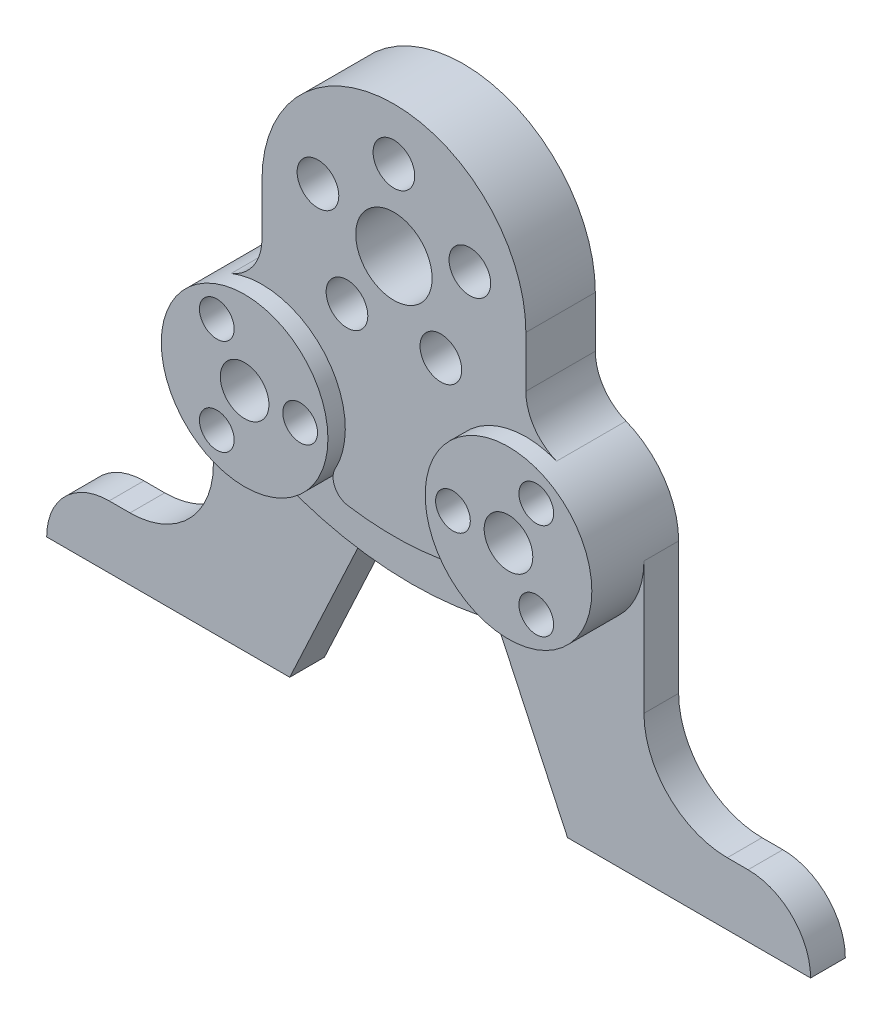
from build123d import *

# Parameters (mm, degrees)
EXTRUDE_1_DEPTH   = 10
EXTRUDE_1_2_DEPTH = 10
SKETCH_1_3_R      = 6
SKETCH_1_3_R_2    = 11
EXTRUDE_2_DEPTH   = 20
EXTRUDE_3_DEPTH   = 15
SKETCH_1_5_R      = 24
SKETCH_1_5_R_2    = 5
SKETCH_1_5_R_3    = 7
EXTRUDE_4_DEPTH   = 25


with BuildPart() as part:
    # Эскиз1 → Бобышка-Вытянуть1 (new body)
    with BuildSketch(Plane.XY):
        with BuildLine():
            ThreePointArc((-50, -70.784609691), (-58.784609691, -62), (-62, -50))
            Line((-62, -50), (-62, -88))
            ThreePointArc((-62, -88), (-69.029437252, -104.970562748), (-86, -112))
            Line((-86, -112), (-92, -112))
            ThreePointArc((-92, -112), (-104.727922061, -117.272077939), (-110, -130))
            Line((-110, -130), (-40, -130))
            Line((-40, -130), (-20.413213913, -87.996001687))
            ThreePointArc((-20.413213913, -87.996001687), (-17.041200429, -84.37997452), (-12.187732979, -83.436586413))
            ThreePointArc((-12.187732979, -83.436586413), (-31.730847168, -79.014307175), (-50, -70.784609691))
        make_face()
    extrude(amount=EXTRUDE_1_DEPTH)



with BuildPart() as body_2:
    # Эскиз1 → Extrude 1 2 (new body)
    with BuildSketch(Plane.XY):
        with BuildLine():
            Line((62, -88), (62, -50))
            ThreePointArc((62, -50), (58.784609691, -62), (50, -70.784609691))
            ThreePointArc((50, -70.784609691), (31.730847168, -79.014307175), (12.187732979, -83.436586413))
            ThreePointArc((12.187732979, -83.436586413), (17.041200429, -84.37997452), (20.413213913, -87.996001687))
            Line((20.413213913, -87.996001687), (40, -130))
            Line((40, -130), (110, -130))
            ThreePointArc((110, -130), (104.727922061, -117.272077939), (92, -112))
            Line((92, -112), (86, -112))
            ThreePointArc((86, -112), (69.029437252, -104.970562748), (62, -88))
        make_face()
    extrude(amount=EXTRUDE_1_2_DEPTH)


with BuildPart() as body_3:
    # Эскиз1<3> → Бобышка-Вытянуть2 (new body)
    with BuildSketch(Plane.XY):
        with BuildLine():
            ThreePointArc((38, 0), (0, 38), (-38, 0))
            Line((-38, 0), (-38, -14.672956535))
            ThreePointArc((-38, -14.672956535), (-40.419617314, -22.540277352), (-46.842105263, -27.688183075))
            ThreePointArc((-46.842105263, -27.688183075), (-42.500910674, -26.425823384), (-38, -26))
            ThreePointArc((-38, -26), (-21.029437252, -33.029437252), (-14, -50))
            ThreePointArc((-14, -50), (-14.740639422, -55.916261107), (-16.916845457, -61.467370864))
            ThreePointArc((-16.916845457, -61.467370864), (-17.009837453, -66.065918092), (-13.307304194, -68.794751467))
            ThreePointArc((-13.307304194, -68.794751467), (0, -69.842886359), (13.307304194, -68.794751467))
            ThreePointArc((13.307304194, -68.794751467), (17.009837453, -66.065918092), (16.916845457, -61.467370864))
            ThreePointArc((16.916845457, -61.467370864), (20.035612902, -34.085201974), (46.842105263, -27.688183075))
            ThreePointArc((46.842105263, -27.688183075), (40.419617314, -22.540277352), (38, -14.672956535))
            Line((38, -14.672956535), (38, 0))
        make_face()
        with Locations((-13.519060803, -18.607390871)):
            Circle(SKETCH_1_3_R, mode=Mode.SUBTRACT)
        Circle(SKETCH_1_3_R_2, mode=Mode.SUBTRACT)
        with Locations((-21.874299875, 7.107390871)):
            Circle(SKETCH_1_3_R, mode=Mode.SUBTRACT)
        with Locations((0, 23)):
            Circle(SKETCH_1_3_R, mode=Mode.SUBTRACT)
        with Locations((13.519060803, -18.607390871)):
            Circle(SKETCH_1_3_R, mode=Mode.SUBTRACT)
        with Locations((21.874299875, 7.107390871)):
            Circle(SKETCH_1_3_R, mode=Mode.SUBTRACT)
    extrude(amount=EXTRUDE_2_DEPTH)


with BuildPart() as part_1:
    add(part.part)

    add(body_2.part)  # Бобышка-Вытянуть3 merges body 2

    add(body_3.part)  # Бобышка-Вытянуть3 merges body 3
    # Эскиз1<4> → Бобышка-Вытянуть3 (add)
    with BuildSketch(Plane.XY):
        with BuildLine():
            ThreePointArc((-16.916845457, -61.467370864), (-31.493952125, -73.10132769), (-50, -70.784609691))
            ThreePointArc((-50, -70.784609691), (-31.730847168, -79.014307175), (-12.187732979, -83.436586413))
            ThreePointArc((-12.187732979, -83.436586413), (0, -84.182069312), (12.187732979, -83.436586413))
            ThreePointArc((12.187732979, -83.436586413), (31.730847168, -79.014307175), (50, -70.784609691))
            ThreePointArc((50, -70.784609691), (31.493952125, -73.10132769), (16.916845457, -61.467370864))
            ThreePointArc((16.916845457, -61.467370864), (17.009837453, -66.065918092), (13.307304194, -68.794751467))
            ThreePointArc((13.307304194, -68.794751467), (0, -69.842886359), (-13.307304194, -68.794751467))
            ThreePointArc((-13.307304194, -68.794751467), (-17.009837453, -66.065918092), (-16.916845457, -61.467370864))
        make_face()
    extrude(amount=EXTRUDE_3_DEPTH)

    # Эскиз1<5> → Бобышка-Вытянуть4 (add)
    # profile 1 of 2: a face of its own
    with BuildSketch(Plane.XY):
        with Locations((-38, -50)):
            Circle(SKETCH_1_5_R)
        with Locations((-46, -63.856406461)):
            Circle(SKETCH_1_5_R_2, mode=Mode.SUBTRACT)
        with Locations((-38, -50)):
            Circle(SKETCH_1_5_R_3, mode=Mode.SUBTRACT)
        with Locations((-22, -50)):
            Circle(SKETCH_1_5_R_2, mode=Mode.SUBTRACT)
        with Locations((-46, -36.143593539)):
            Circle(SKETCH_1_5_R_2, mode=Mode.SUBTRACT)
    # profile 2 of 2: a face of its own
    with BuildSketch(Plane.XY):
        with Locations((38, -50)):
            Circle(SKETCH_1_5_R)
        with Locations((22, -50)):
            Circle(SKETCH_1_5_R_2, mode=Mode.SUBTRACT)
        with Locations((46, -63.856406461)):
            Circle(SKETCH_1_5_R_2, mode=Mode.SUBTRACT)
        with Locations((38, -50)):
            Circle(SKETCH_1_5_R_3, mode=Mode.SUBTRACT)
        with Locations((46, -36.143593539)):
            Circle(SKETCH_1_5_R_2, mode=Mode.SUBTRACT)
    extrude(amount=EXTRUDE_4_DEPTH)


solid = part_1.part
